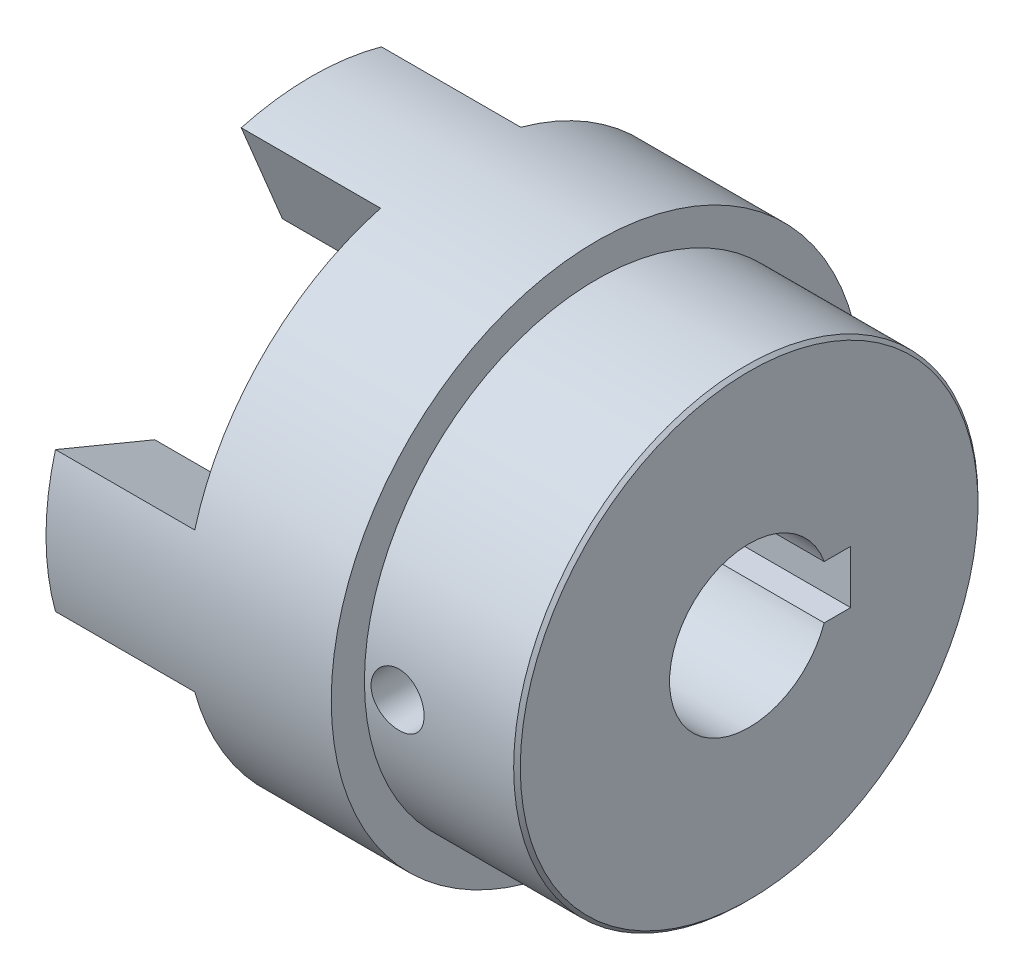
from build123d import *

# Parameters (mm, degrees)
CHAMFER1_SIZE           = 0.5
SKETCH2_OUTSIDE_W       = 108.196
SKETCH2_OUTSIDE_H       = 108.196
CUT_EXTRUDE1_DEPTH      = 21
CUT_EXTRUDE2_DEPTH      = 72.056315694
CUT_EXTRUDE2_DEPTH_BACK = 72.056315694
SKETCH6_R               = 4
CUT_EXTRUDE3_DEPTH      = 72.056315694
CIRPATTERN1_COUNT       = 2
CIRPATTERN1_ANGLE       = 90


with BuildPart() as part:
    # Sketch1 → Revolve1 (revolve)
    with BuildSketch(Plane.XY, mode=Mode.PRIVATE) as revolve1_sk:
        Polygon((-43, 40), (0, 40), (0, 35), (23, 35), (23, 0), (-43, 0), align=None)
    revolve(revolve1_sk.sketch.rotate(Axis((-50.16, 0, 0), (1, 0, 0)), 90), axis=Axis((-50.16, 0, 0), (1, 0, 0)))

    # Chamfer1
    chamfer1_edges = [part.edges().sort_by_distance(p)[0] for p in [
        (23, 0, -35),
    ]]
    chamfer(chamfer1_edges, length=CHAMFER1_SIZE)

    # Sketch2 outside → Cut-Extrude1 (cut)
    with BuildSketch(Plane.ZY.offset(43)):
        Rectangle(SKETCH2_OUTSIDE_W, SKETCH2_OUTSIDE_H)
        with BuildLine():
            Line((38.578346676, -10.569350395), (23.599719808, -4.365))
            ThreePointArc((23.599719808, -4.365), (24, 0), (23.599719808, 4.365))
            Line((23.599719808, 4.365), (38.578346676, 10.569350395))
            ThreePointArc((38.578346676, 10.569350395), (40, 0), (38.578346676, -10.569350395))
        make_face(mode=Mode.SUBTRACT)
        with BuildLine():
            Line((-10.569350395, 38.578346676), (-4.365, 23.599719808))
            ThreePointArc((-4.365, 23.599719808), (0, 24), (4.365, 23.599719808))
            Line((4.365, 23.599719808), (10.569350395, 38.578346676))
            ThreePointArc((10.569350395, 38.578346676), (0, 40), (-10.569350395, 38.578346676))
        make_face(mode=Mode.SUBTRACT)
        with BuildLine():
            Line((-10.569350395, -38.578346676), (-4.365, -23.599719808))
            ThreePointArc((-4.365, -23.599719808), (0, -24), (4.365, -23.599719808))
            Line((4.365, -23.599719808), (10.569350395, -38.578346676))
            ThreePointArc((10.569350395, -38.578346676), (0, -40), (-10.569350395, -38.578346676))
        make_face(mode=Mode.SUBTRACT)
        with BuildLine():
            Line((-38.578346676, 10.569350395), (-23.599719808, 4.365))
            ThreePointArc((-23.599719808, 4.365), (-24, 0), (-23.599719808, -4.365))
            Line((-23.599719808, -4.365), (-38.578346676, -10.569350395))
            ThreePointArc((-38.578346676, -10.569350395), (-40, 0), (-38.578346676, 10.569350395))
        make_face(mode=Mode.SUBTRACT)
    extrude(amount=-CUT_EXTRUDE1_DEPTH, mode=Mode.SUBTRACT)

    # Sketch4 → Cut-Extrude2 (cut, two sides: drawn at the far end of the back side and taken through both)
    with BuildSketch(Plane.ZY.offset(-CUT_EXTRUDE2_DEPTH_BACK)):
        with BuildLine():
            Line((-15.3, -4), (-11.313708499, -4))
            ThreePointArc((-11.313708499, -4), (12, 0), (-11.313708499, 4))
            Line((-11.313708499, 4), (-15.3, 4))
            Line((-15.3, 4), (-15.3, -4))
        make_face()
    extrude(amount=CUT_EXTRUDE2_DEPTH + CUT_EXTRUDE2_DEPTH_BACK, mode=Mode.SUBTRACT)

    # Sketch6 → Cut-Extrude3 (cut, through all)
    with BuildSketch(Plane(origin=(0, 0, 0), x_dir=(1, 0, 0), z_dir=(0, 1, 0))):
        with Locations(Location((5, 0, 0), (0, 0, 270))):
            Circle(SKETCH6_R)
    cut_extrude3 = extrude(amount=-CUT_EXTRUDE3_DEPTH, mode=Mode.SUBTRACT)

    # CirPattern1: Cut-Extrude3 ×2 about axis
    cirpattern1_axis = Axis((0, 0, 0), (-1, 0, 0))
    for i in range(1, CIRPATTERN1_COUNT):
        add(cut_extrude3.rotate(cirpattern1_axis, i * CIRPATTERN1_ANGLE / (CIRPATTERN1_COUNT - 1)), mode=Mode.SUBTRACT)


solid = part.part
